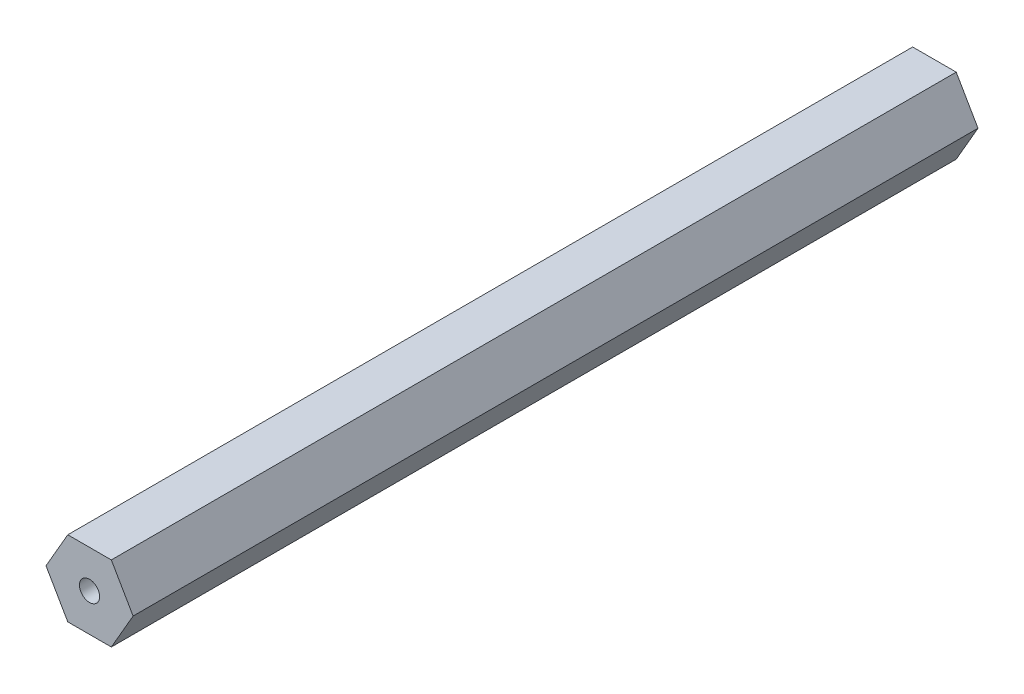
from build123d import *

# Parameters (mm, degrees)
SKETCH1_R           = 1.27
BOSS_EXTRUDE1_DEPTH = 106.68


with BuildPart() as part:
    # Sketch1 → Boss-Extrude1 (new body)
    with BuildSketch(Plane.XY):
        Polygon((16.408039326, -2.667590064), (13.658408669, 2.094909936), (8.159147355, 2.094909936), (5.409516698, -2.667590064), (8.159147355, -7.430090064), (13.658408669, -7.430090064), align=None)
        with Locations((10.908778012, -2.667590064)):
            Circle(SKETCH1_R, mode=Mode.SUBTRACT)
    extrude(amount=BOSS_EXTRUDE1_DEPTH)


solid = part.part
